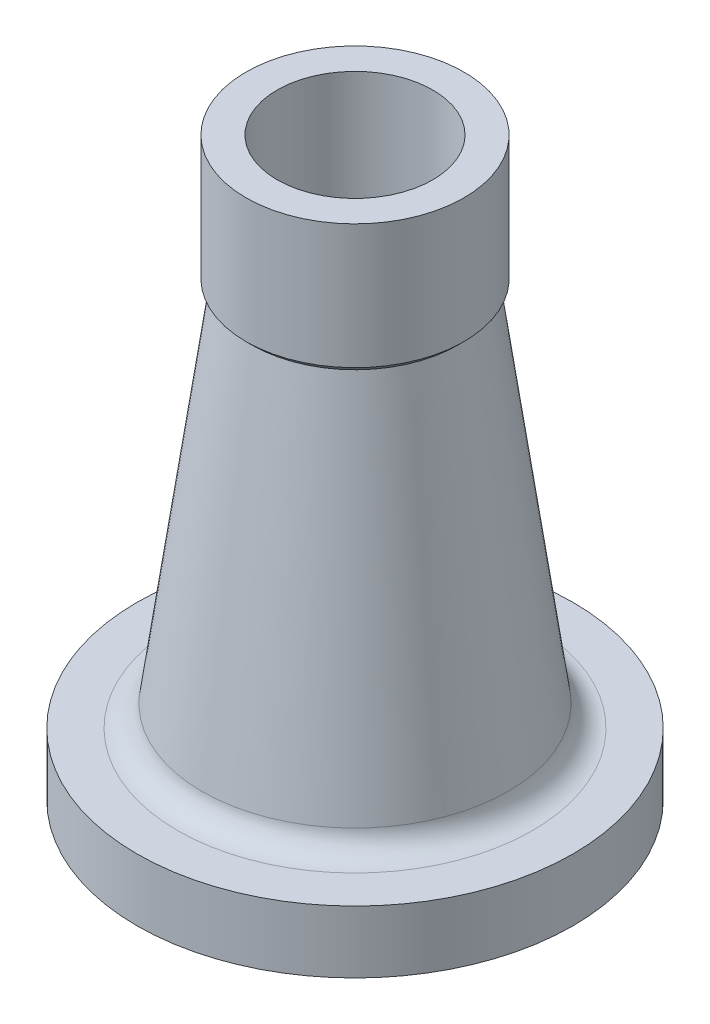
from build123d import *


with BuildPart() as part:
    # Sketch1 → Revolve1 (revolve)
    with BuildSketch(Plane.XY, mode=Mode.PRIVATE) as revolve1_sk:
        with BuildLine():
            Line((70, 0), (70, 20))
            Line((70, 20), (57, 20))
            ThreePointArc((57, 20), (51.745388578, 21.967665559), (49.075606637, 26.902735298))
            Line((49.075606637, 26.902735298), (33, 143))
            Line((33, 143), (35, 145))
            Line((35, 145), (35, 185))
            Line((35, 185), (25, 185))
            Line((25, 185), (25, 127.867048884))
            Line((25, 127.867048884), (42.289929827, 3))
            Line((42.289929827, 3), (48, 3))
            ThreePointArc((48, 3), (49.414213562, 2.414213562), (50, 1))
            Line((50, 1), (50, 0))
            Line((50, 0), (70, 0))
        make_face()
    revolve(revolve1_sk.sketch.rotate(Axis((0, 99.490022173, 0), (0, -1, 0)), 90), axis=Axis((0, 99.490022173, 0), (0, -1, 0)))


solid = part.part
